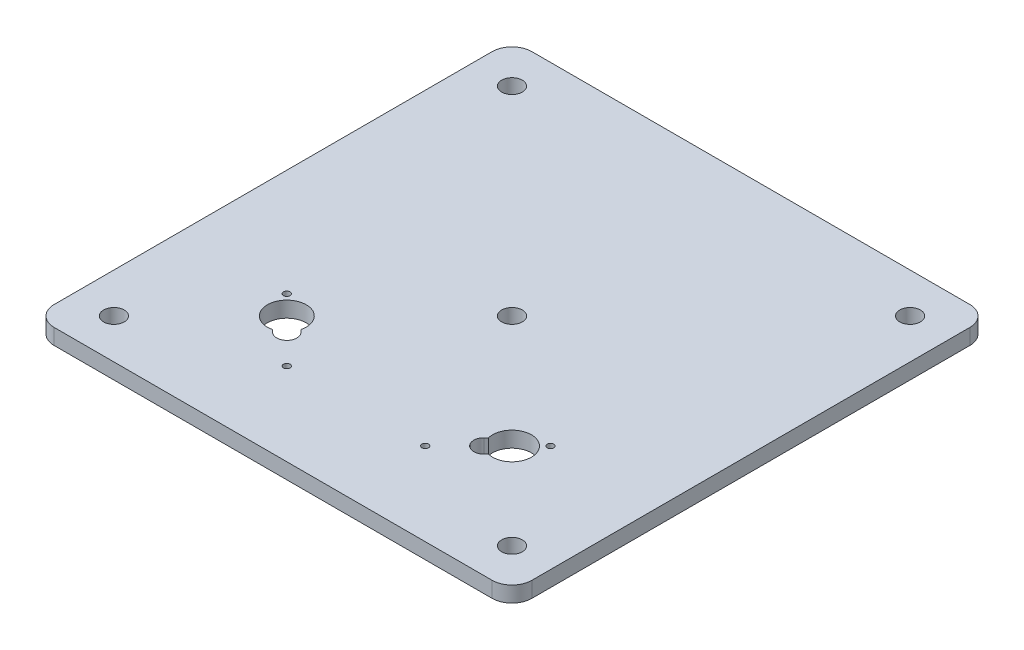
from build123d import *

# Parameters (mm, degrees)
SKETCH1_R           = 3.302
BOSS_EXTRUDE1_DEPTH = 5
SKETCH2_R           = 1.05
CUT_EXTRUDE2_DEPTH  = 108.879006299


with BuildPart() as part:
    # Sketch1 → Boss-Extrude1 (new body)
    with BuildSketch(Plane(origin=(0, 0, 0), x_dir=(1, 0, 0), z_dir=(0, 1, 0))):
        with BuildLine():
            Line((-69.85, 76.2), (69.85, 76.2))
            ThreePointArc((69.85, 76.2), (74.340128061, 74.340128061), (76.2, 69.85))
            Line((76.2, 69.85), (76.2, -69.85))
            ThreePointArc((76.2, -69.85), (74.340128061, -74.340128061), (69.85, -76.2))
            Line((69.85, -76.2), (-69.85, -76.2))
            ThreePointArc((-69.85, -76.2), (-74.340128061, -74.340128061), (-76.2, -69.85))
            Line((-76.2, -69.85), (-76.2, 69.85))
            ThreePointArc((-76.2, 69.85), (-74.340128061, 74.340128061), (-69.85, 76.2))
        make_face()
        with Locations(Location((63.5, 63.5, 0), (0, 0, 270))):
            Circle(SKETCH1_R, mode=Mode.SUBTRACT)
        with Locations(Location((63.5, -63.5, 0), (0, 0, 90))):
            Circle(SKETCH1_R, mode=Mode.SUBTRACT)
        with Locations(Location((-63.5, -63.5, 0), (0, 0, 270))):
            Circle(SKETCH1_R, mode=Mode.SUBTRACT)
        with Locations(Location((-63.5, 63.5, 0), (0, 0, 90))):
            Circle(SKETCH1_R, mode=Mode.SUBTRACT)
        with Locations(Location((0, 0, 0), (0, 0, 270))):
            Circle(SKETCH1_R, mode=Mode.SUBTRACT)
    extrude(amount=BOSS_EXTRUDE1_DEPTH)

    # Sketch2 → Cut-Extrude2 (cut, through all)
    with BuildSketch(Plane(origin=(0, 0, 0), x_dir=(1, 0, 0), z_dir=(0, 1, 0))):
        with Locations(Location((-42.055175811, -29.786873157, 0), (0, 0, 270))):
            Circle(SKETCH2_R)
        with Locations(Location((-22.079409243, -49.762639726, 0), (0, 0, 270))):
            Circle(SKETCH2_R)
        with Locations(Location((22.079409243, -49.762639726, 0), (0, 0, 90))):
            Circle(SKETCH2_R)
        with Locations(Location((42.055175811, -29.786873157, 0), (0, 0, 90))):
            Circle(SKETCH2_R)
        with BuildLine():
            Line((-33.693638124, -42.673894245), (-34.428769513, -41.938762855))
            ThreePointArc((-34.428769513, -41.938762855), (-40.305086528, -31.536962441), (-29.903286113, -37.413279456))
            Line((-29.903286113, -37.413279456), (-29.168154724, -38.148410845))
            ThreePointArc((-29.168154724, -38.148410845), (-29.168154724, -42.673894245), (-33.693638124, -42.673894245))
        make_face()
        with BuildLine():
            Line((33.693638124, -42.673894245), (34.428769513, -41.938762855))
            ThreePointArc((34.428769513, -41.938762855), (40.305086528, -31.536962441), (29.903286113, -37.413279456))
            Line((29.903286113, -37.413279456), (29.168154724, -38.148410845))
            ThreePointArc((29.168154724, -38.148410845), (29.168154724, -42.673894245), (33.693638124, -42.673894245))
        make_face()
    extrude(amount=CUT_EXTRUDE2_DEPTH, mode=Mode.SUBTRACT)


solid = part.part
